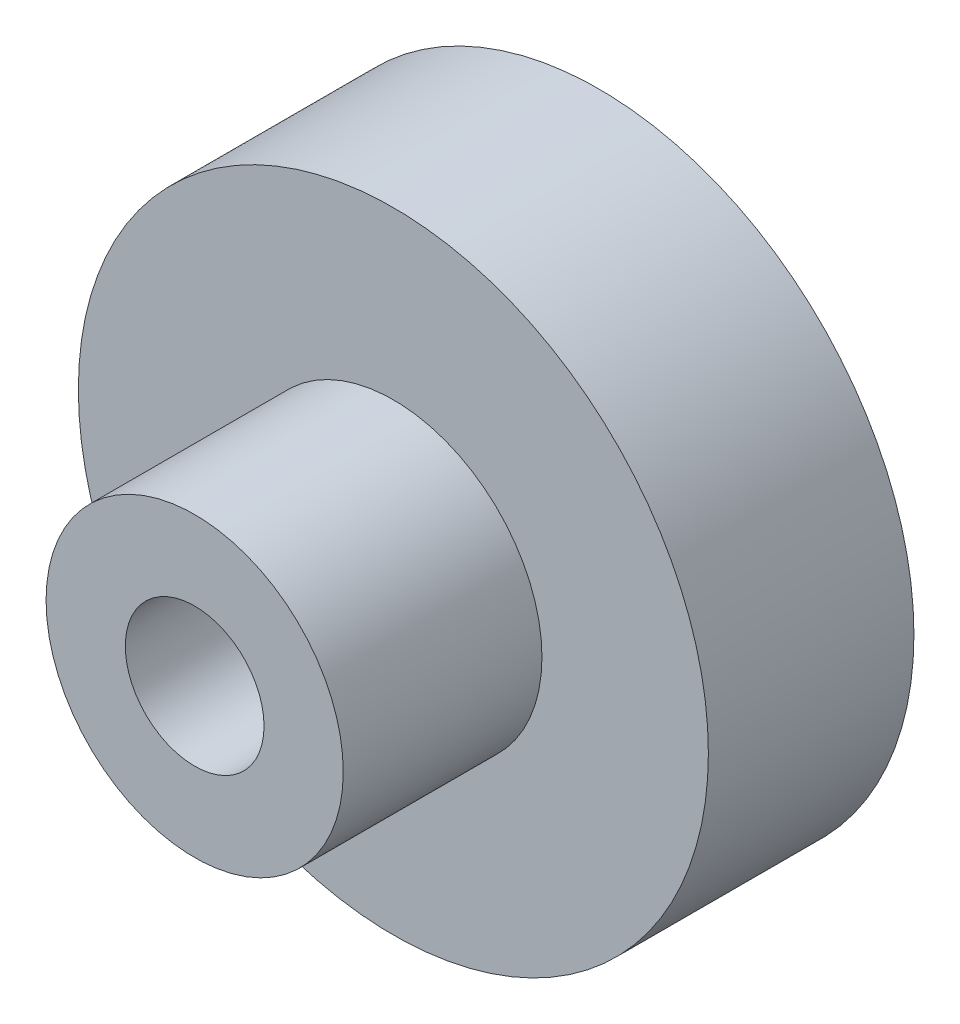
from build123d import *

# Parameters (mm, degrees)
CROQUIS1_R              = 18.39
SALIENTE_EXTRUIR1_DEPTH = 6
CROQUIS3_R              = 8.675
SALIENTE_EXTRUIR2_DEPTH = 11.6
CROQUIS4_R              = 4.05
CORTAR_EXTRUIR1_DEPTH   = 31.6


with BuildPart() as part:
    # Croquis1 → Saliente-Extruir1 (new, symmetric)
    with BuildSketch(Plane.XY):
        Circle(CROQUIS1_R)
    extrude(amount=SALIENTE_EXTRUIR1_DEPTH, both=True)

    # Croquis3 → Saliente-Extruir2 (add)
    with BuildSketch(Plane.XY.offset(6)):
        Circle(CROQUIS3_R)
    extrude(amount=SALIENTE_EXTRUIR2_DEPTH)

    # Croquis4 → Cortar-Extruir1 (cut)
    with BuildSketch(Plane.XY.offset(17.6)):
        Circle(CROQUIS4_R)
    extrude(amount=-CORTAR_EXTRUIR1_DEPTH, mode=Mode.SUBTRACT)


solid = part.part
